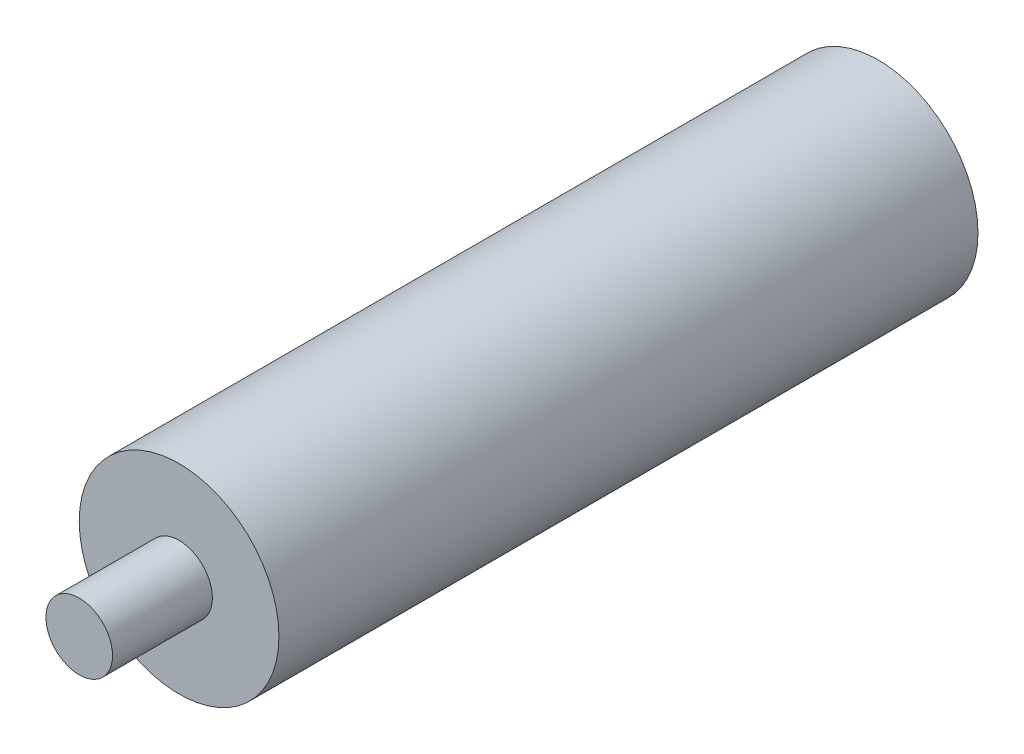
from build123d import *

# Parameters (mm, degrees)
SKETCH_1_R      = 3
EXTRUDE_1_DEPTH = 21
SKETCH_2_R      = 1
EXTRUDE_2_DEPTH = 3


with BuildPart() as part:
    # 스케치1 → 보스-돌출1 (new body)
    with BuildSketch(Plane.XY):
        with Locations(Location((0, 0, 0), (0, 0, 180))):
            Circle(SKETCH_1_R)
    extrude(amount=EXTRUDE_1_DEPTH)

    # 스케치2 → 보스-돌출2 (add)
    with BuildSketch(Plane.XY.offset(21)):
        Circle(SKETCH_2_R)
    extrude(amount=EXTRUDE_2_DEPTH)


solid = part.part
